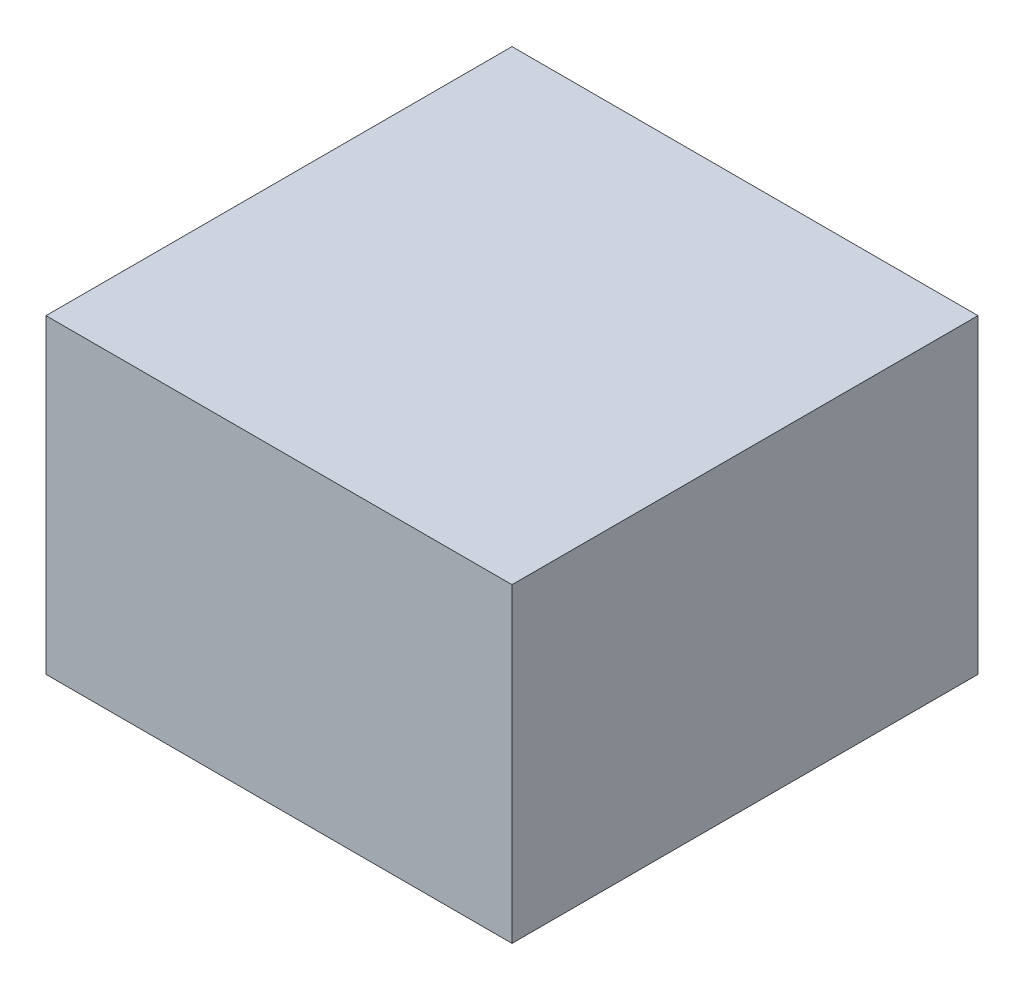
from build123d import *

# Parameters (mm, degrees)
SKETCH1_W           = 60
SKETCH1_H           = 40
BOSS_EXTRUDE1_DEPTH = 60
SKETCH2_W           = 40.5
SKETCH2_H           = 20
CUT_EXTRUDE1_DEPTH  = 39
SKETCH3_R           = 2
CUT_EXTRUDE2_DEPTH  = 5


with BuildPart() as part:
    # Sketch1 → Boss-Extrude1 (new body)
    with BuildSketch(Plane.XY):
        Rectangle(SKETCH1_W, SKETCH1_H)
    extrude(amount=BOSS_EXTRUDE1_DEPTH)

    # Sketch2 → Cut-Extrude1 (cut)
    with BuildSketch(Plane(origin=(0, 0, 0), x_dir=(-1, 0, 0), z_dir=(0, 0, -1))):
        Rectangle(SKETCH2_W, SKETCH2_H)
    extrude(amount=-CUT_EXTRUDE1_DEPTH, mode=Mode.SUBTRACT)

    # Sketch3 → Cut-Extrude2 (cut)
    with BuildSketch(Plane(origin=(0, 0, 0), x_dir=(-1, 0, 0), z_dir=(0, 0, -1))):
        with Locations((26, 17.333333333)):
            Circle(SKETCH3_R)
        with Locations(Location((-26, 17.333333333, 0), (0, 0, 180))):
            Circle(SKETCH3_R)
        with Locations(Location((26, -17.333333333, 0), (0, 0, 180))):
            Circle(SKETCH3_R)
        with Locations((-26, -17.333333333)):
            Circle(SKETCH3_R)
    extrude(amount=-CUT_EXTRUDE2_DEPTH, mode=Mode.SUBTRACT)


solid = part.part
